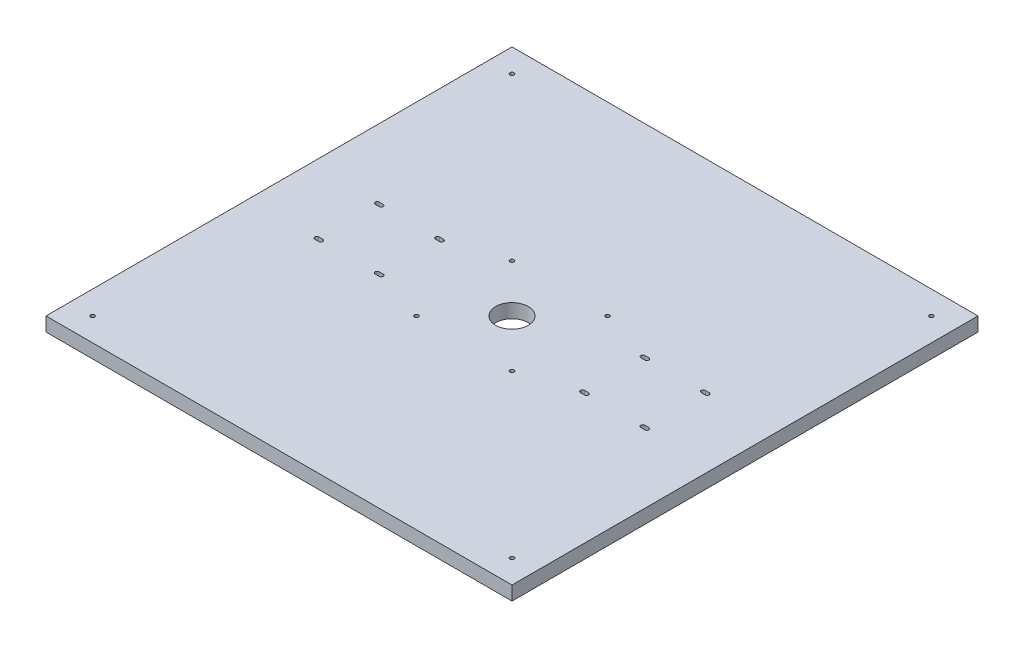
from build123d import *

# Parameters (mm, degrees)
CROQUIS1_W              = 500
CROQUIS1_H              = 500
SALIENTE_EXTRUIR1_DEPTH = 15
CROQUIS2_R              = 2.15
CORTAR_EXTRUIR1_DEPTH   = 15
CROQUIS3_R              = 2.15
CORTAR_EXTRUIR3_DEPTH   = 15
CROQUIS4_R              = 17.5
CORTAR_EXTRUIR4_DEPTH   = 40


with BuildPart() as part:
    # Croquis1 → Saliente-Extruir1 (new body)
    with BuildSketch(Plane(origin=(0, 0, 0), x_dir=(1, 0, 0), z_dir=(0, 1, 0))):
        Rectangle(CROQUIS1_W, CROQUIS1_H)
    extrude(amount=SALIENTE_EXTRUIR1_DEPTH)

    # Croquis2 → Cortar-Extruir1 (cut)
    with BuildSketch(Plane(origin=(0, 15, 0), x_dir=(1, 0, 0), z_dir=(0, 1, 0))):
        with Locations(Location((-225, 225, 0), (0, 0, 270))):
            Circle(CROQUIS2_R)
        with Locations(Location((225, 225, 0), (0, 0, 90))):
            Circle(CROQUIS2_R)
        with Locations(Location((225, -225, 0), (0, 0, 270))):
            Circle(CROQUIS2_R)
        with Locations(Location((-225, -225, 0), (0, 0, 90))):
            Circle(CROQUIS2_R)
    extrude(amount=-CORTAR_EXTRUIR1_DEPTH, mode=Mode.SUBTRACT)

    # Croquis3 → Cortar-Extruir3 (cut)
    with BuildSketch(Plane(origin=(0, 15, 0), x_dir=(1, 0, 0), z_dir=(0, 1, 0))):
        with Locations(Location((-51.265, 51.265, 0), (0, 0, 270))):
            Circle(CROQUIS3_R)
        with Locations(Location((-51.265, -51.265, 0), (0, 0, 270))):
            Circle(CROQUIS3_R)
        with Locations(Location((51.265, -51.265, 0), (0, 0, 270))):
            Circle(CROQUIS3_R)
        with Locations(Location((51.265, 51.265, 0), (0, 0, 270))):
            Circle(CROQUIS3_R)
        with BuildLine():
            Line((-177.115, 34.55), (-172.815, 34.55))
            ThreePointArc((-172.815, 34.55), (-170.665, 32.4), (-172.815, 30.25))
            Line((-172.815, 30.25), (-177.115, 30.25))
            ThreePointArc((-177.115, 30.25), (-179.265, 32.4), (-177.115, 34.55))
        make_face()
        with BuildLine():
            Line((-177.115, -30.25), (-172.815, -30.25))
            ThreePointArc((-172.815, -30.25), (-170.665, -32.4), (-172.815, -34.55))
            Line((-172.815, -34.55), (-177.115, -34.55))
            ThreePointArc((-177.115, -34.55), (-179.265, -32.4), (-177.115, -30.25))
        make_face()
        with BuildLine():
            Line((-112.315, -30.25), (-108.015, -30.25))
            ThreePointArc((-108.015, -30.25), (-105.865, -32.4), (-108.015, -34.55))
            Line((-108.015, -34.55), (-112.315, -34.55))
            ThreePointArc((-112.315, -34.55), (-114.465, -32.4), (-112.315, -30.25))
        make_face()
        with BuildLine():
            Line((-112.315, 34.55), (-108.015, 34.55))
            ThreePointArc((-108.015, 34.55), (-105.865, 32.4), (-108.015, 30.25))
            Line((-108.015, 30.25), (-112.315, 30.25))
            ThreePointArc((-112.315, 30.25), (-114.465, 32.4), (-112.315, 34.55))
        make_face()
        with BuildLine():
            Line((177.115, -30.25), (172.815, -30.25))
            ThreePointArc((172.815, -30.25), (170.665, -32.4), (172.815, -34.55))
            Line((172.815, -34.55), (177.115, -34.55))
            ThreePointArc((177.115, -34.55), (179.265, -32.4), (177.115, -30.25))
        make_face()
        with BuildLine():
            Line((177.115, 34.55), (172.815, 34.55))
            ThreePointArc((172.815, 34.55), (170.665, 32.4), (172.815, 30.25))
            Line((172.815, 30.25), (177.115, 30.25))
            ThreePointArc((177.115, 30.25), (179.265, 32.4), (177.115, 34.55))
        make_face()
        with BuildLine():
            Line((112.315, -30.25), (108.015, -30.25))
            ThreePointArc((108.015, -30.25), (105.865, -32.4), (108.015, -34.55))
            Line((108.015, -34.55), (112.315, -34.55))
            ThreePointArc((112.315, -34.55), (114.465, -32.4), (112.315, -30.25))
        make_face()
        with BuildLine():
            Line((112.315, 34.55), (108.015, 34.55))
            ThreePointArc((108.015, 34.55), (105.865, 32.4), (108.015, 30.25))
            Line((108.015, 30.25), (112.315, 30.25))
            ThreePointArc((112.315, 30.25), (114.465, 32.4), (112.315, 34.55))
        make_face()
    extrude(amount=-CORTAR_EXTRUIR3_DEPTH, mode=Mode.SUBTRACT)

    # Croquis4 → Cortar-Extruir4 (cut)
    with BuildSketch(Plane(origin=(0, 15, 0), x_dir=(1, 0, 0), z_dir=(0, 1, 0))):
        with Locations(Location((0, 0, 0), (0, 0, 270))):
            Circle(CROQUIS4_R)
    extrude(amount=-CORTAR_EXTRUIR4_DEPTH, mode=Mode.SUBTRACT)


solid = part.part
